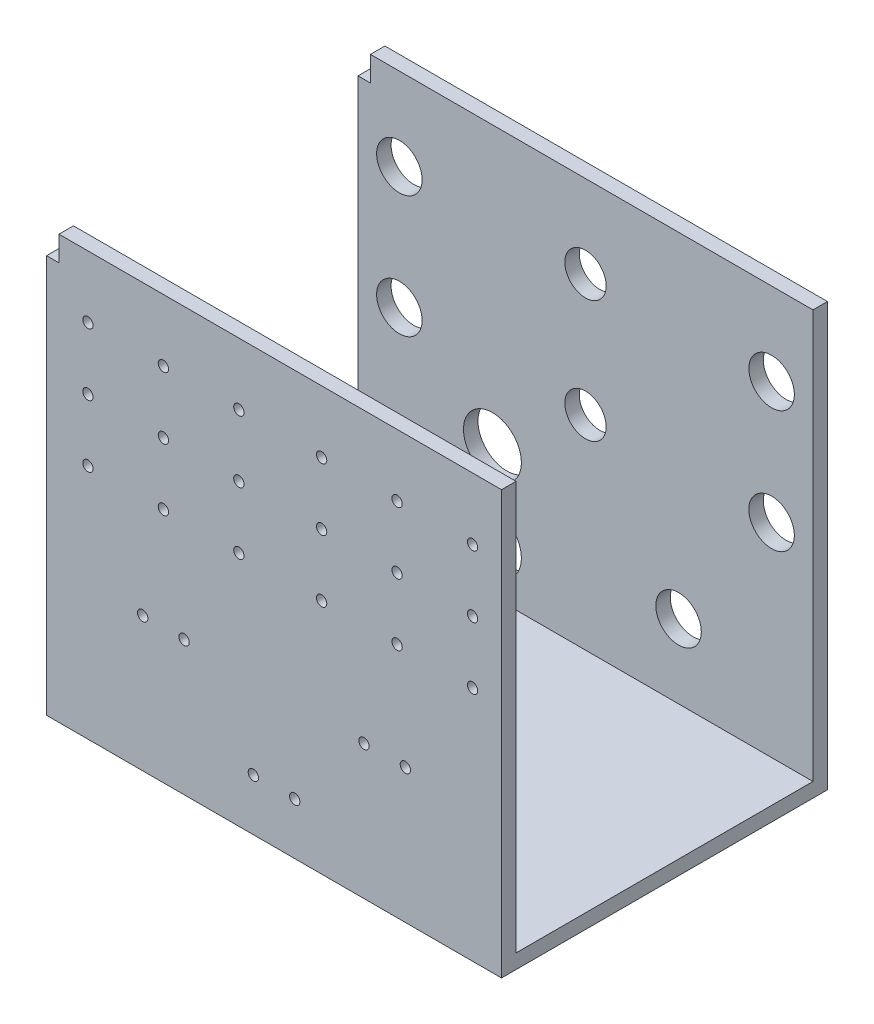
from build123d import *

# Parameters (mm, degrees)
CROQUIS1_W              = 220
CROQUIS1_H              = 204.5
SALIENTE_EXTRUIR1_DEPTH = 7
CROQUIS2_R              = 11
CROQUIS2_R_2            = 10
CROQUIS2_R_3            = 14
CORTAR_EXTRUIR1_DEPTH   = 151.346474851
CROQUIS3_W              = 6
CROQUIS3_H              = 12
CORTAR_EXTRUIR2_DEPTH   = 10
CROQUIS4_W              = 220
CROQUIS4_H              = 7
SALIENTE_EXTRUIR2_DEPTH = 150.6
CROQUIS5_W              = 220
CROQUIS5_H              = 7
SALIENTE_EXTRUIR3_DEPTH = 197.5
CROQUIS6_W              = 6
CROQUIS6_H              = 12
CORTAR_EXTRUIR3_DEPTH   = 150.6
CROQUIS7_R              = 2.5
CORTAR_EXTRUIR4_DEPTH   = 10
CROQUIS8_W              = 20
CROQUIS8_H              = 15
SALIENTE_EXTRUIR4_DEPTH = 197.5
CROQUIS9_W              = 110.5
CROQUIS9_H              = 4
CORTAR_EXTRUIR5_DEPTH   = 94
CROQUIS11_R             = 2.5
CORTAR_EXTRUIR6_DEPTH   = 10
CORTAR_EXTRUIR7_REACH   = 188.514
CROQUIS10_W             = 13.75
CROQUIS10_H             = 75
CORTAR_EXTRUIR8_REACH   = 282.639
CROQUIS12_W             = 10.25034787
CROQUIS12_H             = 5.500172095
CROQUIS12_W_2           = 10.24965213
CROQUIS13_W             = 3
CROQUIS13_H             = 5.499827905
CORTAR_EXTRUIR9_DEPTH   = 7
CORTAR_EXTRUIR10_DEPTH  = 15
SALIENTE_EXTRUIR5_DEPTH = 15
CROQUIS19_R             = 2
CROQUIS19_R_2           = 1.999827905
CORTAR_EXTRUIR13_DEPTH  = 276.579407794
CROQUIS20_W             = 150
CROQUIS20_H             = 15
CORTAR_EXTRUIR14_DEPTH  = 197.5


with BuildPart() as part:
    # Croquis1 → Saliente-Extruir1 (new body)
    with BuildSketch(Plane.XY):
        Rectangle(CROQUIS1_W, CROQUIS1_H)
    extrude(amount=SALIENTE_EXTRUIR1_DEPTH)

    # Croquis2 → Cortar-Extruir1 (cut, through all)
    with BuildSketch(Plane.XY.offset(7)):
        with Locations((-90, 62.25)):
            Circle(CROQUIS2_R)
        with Locations(Location((90, 62.25, 0), (0, 0, 180))):
            Circle(CROQUIS2_R)
        with Locations((0, 62.25)):
            Circle(CROQUIS2_R_2)
        with Locations((90, 3.25)):
            Circle(CROQUIS2_R)
        with Locations(Location((0, 3.25, 0), (0, 0, 180))):
            Circle(CROQUIS2_R_2)
        with Locations(Location((-90, 3.25, 0), (0, 0, 180))):
            Circle(CROQUIS2_R)
        with Locations((-45, -32.25)):
            Circle(CROQUIS2_R_3)
        with Locations((-45, -72.25)):
            Circle(CROQUIS2_R_3)
        with Locations((45, -59.625285127)):
            Circle(CROQUIS2_R)
    extrude(amount=-CORTAR_EXTRUIR1_DEPTH, mode=Mode.SUBTRACT)

    # Croquis3 → Cortar-Extruir2 (cut)
    with BuildSketch(Plane.XY.offset(7)):
        with Locations((-107, 96.25)):
            Rectangle(CROQUIS3_W, CROQUIS3_H)
    extrude(amount=-CORTAR_EXTRUIR2_DEPTH, mode=Mode.SUBTRACT)

    # Croquis4 → Saliente-Extruir2 (add)
    with BuildSketch(Plane.XY.offset(7)):
        with Locations((0, -98.75)):
            Rectangle(CROQUIS4_W, CROQUIS4_H)
    extrude(amount=SALIENTE_EXTRUIR2_DEPTH)

    # Croquis5 → Saliente-Extruir3 (add)
    with BuildSketch(Plane(origin=(0, -95.25, 0), x_dir=(1, 0, 0), z_dir=(0, 1, 0))):
        with Locations((0, -154.1)):
            Rectangle(CROQUIS5_W, CROQUIS5_H)
    extrude(amount=SALIENTE_EXTRUIR3_DEPTH)

    # Croquis6 → Cortar-Extruir3 (cut)
    with BuildSketch(Plane(origin=(0, 0, 150.6), x_dir=(-1, 0, 0), z_dir=(0, 0, -1))):
        with Locations((107, 96.25)):
            Rectangle(CROQUIS6_W, CROQUIS6_H)
    extrude(amount=-CORTAR_EXTRUIR3_DEPTH, mode=Mode.SUBTRACT)

    # Croquis7 → Cortar-Extruir4 (cut)
    with BuildSketch(Plane.XY.offset(157.6)):
        with Locations((-90, 72.25)):
            Circle(CROQUIS7_R)
        with Locations((-17, 72.25)):
            Circle(CROQUIS7_R)
        with Locations((-53.5, 72.25)):
            Circle(CROQUIS7_R)
        with Locations((96, 72.25)):
            Circle(CROQUIS7_R)
        with Locations((59.5, 72.25)):
            Circle(CROQUIS7_R)
        with Locations((23, 72.25)):
            Circle(CROQUIS7_R)
        with Locations((96, 42.25)):
            Circle(CROQUIS7_R)
        with Locations((59.5, 42.25)):
            Circle(CROQUIS7_R)
        with Locations((23, 42.25)):
            Circle(CROQUIS7_R)
        with Locations((-17, 42.25)):
            Circle(CROQUIS7_R)
        with Locations((-53.5, 42.25)):
            Circle(CROQUIS7_R)
        with Locations((-90, 42.25)):
            Circle(CROQUIS7_R)
        with Locations((96, 12.25)):
            Circle(CROQUIS7_R)
        with Locations((59.5, 12.25)):
            Circle(CROQUIS7_R)
        with Locations((23, 12.25)):
            Circle(CROQUIS7_R)
        with Locations((-17, 12.25)):
            Circle(CROQUIS7_R)
        with Locations((-53.5, 12.25)):
            Circle(CROQUIS7_R)
        with Locations((-90, 12.25)):
            Circle(CROQUIS7_R)
    extrude(amount=-CORTAR_EXTRUIR4_DEPTH, mode=Mode.SUBTRACT)

    # Croquis8 → Saliente-Extruir4 (add)
    with BuildSketch(Plane(origin=(0, -95.25, 0), x_dir=(1, 0, 0), z_dir=(0, 1, 0))):
        with Locations((-50, -103.1)):
            Rectangle(CROQUIS8_W, CROQUIS8_H)
        with Locations((50, -103.1)):
            Rectangle(CROQUIS8_W, CROQUIS8_H)
    extrude(amount=SALIENTE_EXTRUIR4_DEPTH)

    # Croquis9 → Cortar-Extruir5 (cut)
    with BuildSketch(Plane(origin=(0, 102.25, 0), x_dir=(1, 0, 0), z_dir=(0, 1, 0))):
        with Locations((-0.00034787, -103.099827905)):
            Rectangle(CROQUIS9_W, CROQUIS9_H)
    extrude(amount=-CORTAR_EXTRUIR5_DEPTH, mode=Mode.SUBTRACT)

    # Croquis11 → Cortar-Extruir6 (cut)
    with BuildSketch(Plane.XY.offset(157.6)):
        with Locations((-10, -77.25)):
            Circle(CROQUIS11_R)
        with Locations((10, -77.25)):
            Circle(CROQUIS11_R)
        with Locations((-63.5, -37.25)):
            Circle(CROQUIS11_R)
        with Locations((-43.5, -37.25)):
            Circle(CROQUIS11_R)
        with Locations((43.5, -37.25)):
            Circle(CROQUIS11_R)
        with Locations((63.5, -37.25)):
            Circle(CROQUIS11_R)
    extrude(amount=-CORTAR_EXTRUIR6_DEPTH, mode=Mode.SUBTRACT)

    # Cortar-Extruir7: up to this face of the body (flat: up to its plane)
    cortar_extruir7_end = Plane(part.part.faces().sort_by_distance((-50, 3.5, 95.6))[0])
    # Croquis10 → Cortar-Extruir7 (cut, up to the picked face)
    with BuildSketch(Plane.XY.offset(110.6), mode=Mode.PRIVATE) as cortar_extruir7_sk1:
        with Locations((-46.875, 57.75)):
            Rectangle(CROQUIS10_W, CROQUIS10_H)
    cortar_extruir7_tool1 = split(extrude(cortar_extruir7_sk1.sketch, amount=-CORTAR_EXTRUIR7_REACH, mode=Mode.PRIVATE), bisect_by=cortar_extruir7_end, keep=Keep.BOTH, mode=Mode.PRIVATE)
    # Croquis10 → Cortar-Extruir7 (cut, up to the picked face)
    with BuildSketch(Plane.XY.offset(110.6), mode=Mode.PRIVATE) as cortar_extruir7_sk2:
        with Locations((46.875, 57.75)):
            Rectangle(CROQUIS10_W, CROQUIS10_H)
    cortar_extruir7_tool2 = split(extrude(cortar_extruir7_sk2.sketch, amount=-CORTAR_EXTRUIR7_REACH, mode=Mode.PRIVATE), bisect_by=cortar_extruir7_end, keep=Keep.BOTH, mode=Mode.PRIVATE)
    add(cortar_extruir7_tool1.solids().sort_by(Axis((-46.875, 57.75, 110.6), (0, 0, -1)))[0], mode=Mode.SUBTRACT)
    add(cortar_extruir7_tool2.solids().sort_by(Axis((46.875, 57.75, 110.6), (0, 0, -1)))[0], mode=Mode.SUBTRACT)

    # Cortar-Extruir8: up to this face of the body (flat: up to its plane)
    cortar_extruir8_end = Plane(part.part.faces().sort_by_distance((-47.625173935, 8.25, 103.099827905))[0])
    # Croquis12 → Cortar-Extruir8 (cut, up to the picked face)
    with BuildSketch(Plane(origin=(0, 102.25, 0), x_dir=(1, 0, 0), z_dir=(0, 1, 0)), mode=Mode.PRIVATE) as cortar_extruir8_sk1:
        with Locations((-45.125173935, -107.849913953)):
            Rectangle(CROQUIS12_W, CROQUIS12_H)
    cortar_extruir8_tool1 = split(extrude(cortar_extruir8_sk1.sketch, amount=-CORTAR_EXTRUIR8_REACH, mode=Mode.PRIVATE), bisect_by=cortar_extruir8_end, keep=Keep.BOTH, mode=Mode.PRIVATE)
    # Croquis12 → Cortar-Extruir8 (cut, up to the picked face)
    with BuildSketch(Plane(origin=(0, 102.25, 0), x_dir=(1, 0, 0), z_dir=(0, 1, 0)), mode=Mode.PRIVATE) as cortar_extruir8_sk2:
        with Locations((45.124826065, -107.849913953)):
            Rectangle(CROQUIS12_W_2, CROQUIS12_H)
    cortar_extruir8_tool2 = split(extrude(cortar_extruir8_sk2.sketch, amount=-CORTAR_EXTRUIR8_REACH, mode=Mode.PRIVATE), bisect_by=cortar_extruir8_end, keep=Keep.BOTH, mode=Mode.PRIVATE)
    add(cortar_extruir8_tool1.solids().sort_by(Axis((-45.125174, 102.25, 107.849914), (0, -1, 0)))[0], mode=Mode.SUBTRACT)
    add(cortar_extruir8_tool2.solids().sort_by(Axis((45.124826, 102.25, 107.849914), (0, -1, 0)))[0], mode=Mode.SUBTRACT)

    # Croquis13 → Cortar-Extruir9 (cut)
    with BuildSketch(Plane(origin=(0, 102.25, 0), x_dir=(1, 0, 0), z_dir=(0, 1, 0))):
        with Locations((-41.5, -98.349913953)):
            Rectangle(CROQUIS13_W, CROQUIS13_H)
        with Locations((41.5, -98.349913953)):
            Rectangle(CROQUIS13_W, CROQUIS13_H)
    extrude(amount=-CORTAR_EXTRUIR9_DEPTH, mode=Mode.SUBTRACT)

    # Croquis14 → Cortar-Extruir10 (cut)
    with BuildSketch(Plane.XY.offset(110.6)):
        Polygon((-40, -10.25), (-51.479605867, -10.25), (-60, -10.25), (-60, -60.25), (-40, -60.25), align=None)
    extrude(amount=-CORTAR_EXTRUIR10_DEPTH, mode=Mode.SUBTRACT)


with BuildPart() as cortar_extruir10_piece_1:
    # of the separate pieces the step leaves, piece 1, a body of its own (cortar_extruir10_pieces)
    add(part.part.solids().sort_by_distance((-104, 102.25, 0))[0])



with BuildPart() as cortar_extruir10_piece_2:
    # of the separate pieces the step leaves, piece 2, a body of its own (cortar_extruir10_pieces)
    add(part.part.solids().sort_by_distance((-40, -10.25, 95.6))[0])


with BuildPart() as cortar_extruir10_piece_1_1:
    add(cortar_extruir10_piece_1.part)

    add(cortar_extruir10_piece_2.part)  # Saliente-Extruir5 merges Cortar-Extruir10 piece 2
    # Croquis15 → Saliente-Extruir5 (add)
    with BuildSketch(Plane.XY.offset(110.6)):
        Polygon((-60, 19.75), (-90, 19.75), (-90, -95.25), (-60, -95.25), (-60, -60.25), (-66.476045764, -60.25), (-66.476045764, -10.25), (-60, -10.25), align=None)
    extrude(amount=-SALIENTE_EXTRUIR5_DEPTH)

    # Croquis19 → Cortar-Extruir13 (cut, through all)
    with BuildSketch(Plane(origin=(0, -95.25, 0), x_dir=(1, 0, 0), z_dir=(0, 1, 0))):
        with Locations(Location((-65, -103.1, 0), (0, 0, 270))):
            Circle(CROQUIS19_R)
        with Locations(Location((51.5, -103.1, 0), (0, 0, 270))):
            Circle(CROQUIS19_R_2)
    extrude(amount=-CORTAR_EXTRUIR13_DEPTH, mode=Mode.SUBTRACT)

    # Croquis20 → Cortar-Extruir14 (cut)
    with BuildSketch(Plane(origin=(0, 102.25, 0), x_dir=(1, 0, 0), z_dir=(0, 1, 0))):
        with Locations((-15, -103.1)):
            Rectangle(CROQUIS20_W, CROQUIS20_H)
    extrude(amount=-CORTAR_EXTRUIR14_DEPTH, mode=Mode.SUBTRACT)


solid = cortar_extruir10_piece_1_1.part
